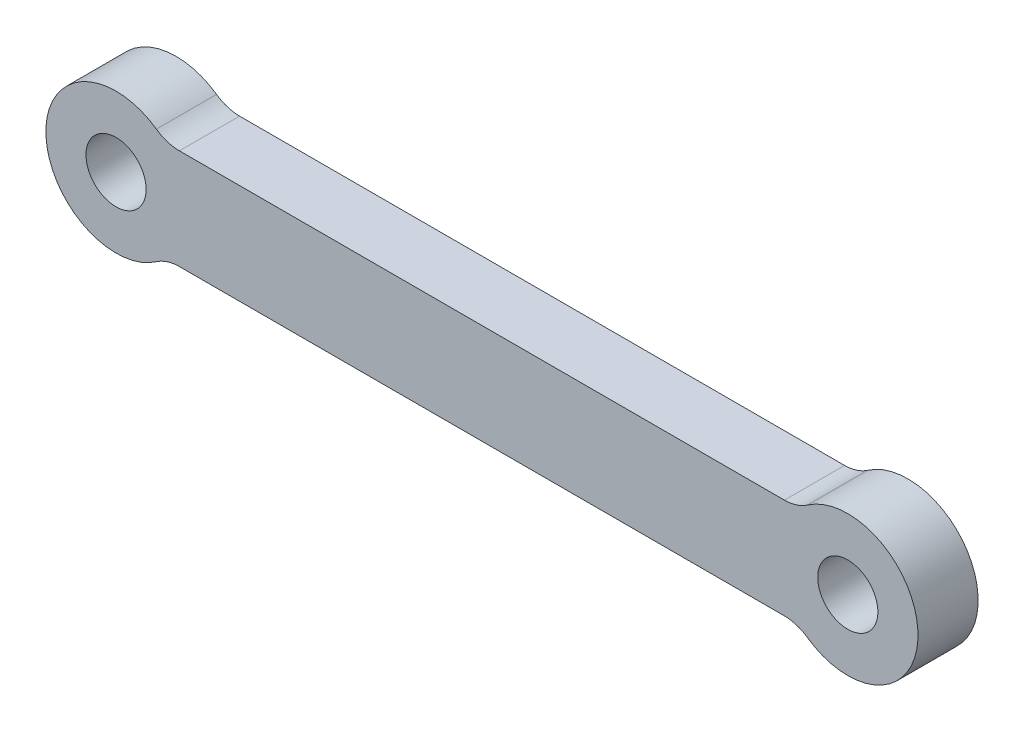
from build123d import *

# Parameters (mm, degrees)
SKETCH_1_R      = 1.5
EXTRUDE_1_DEPTH = 3


with BuildPart() as part:
    # 草图1 → 凸台-拉伸1 (new body)
    with BuildSketch(Plane.XY):
        with BuildLine():
            Line((3.16227766, 2.5), (33.33772234, 2.5))
            ThreePointArc((33.33772234, 2.5), (33.940745029, 2.593074822), (34.487641489, 2.863636364))
            ThreePointArc((34.487641489, 2.863636364), (40, 0), (34.487641489, -2.863636364))
            ThreePointArc((34.487641489, -2.863636364), (33.940745029, -2.593074822), (33.33772234, -2.5))
            Line((33.33772234, -2.5), (3.16227766, -2.5))
            ThreePointArc((3.16227766, -2.5), (2.559254971, -2.593074822), (2.012358511, -2.863636364))
            ThreePointArc((2.012358511, -2.863636364), (-3.5, 0), (2.012358511, 2.863636364))
            ThreePointArc((2.012358511, 2.863636364), (2.559254971, 2.593074822), (3.16227766, 2.5))
        make_face()
        Circle(SKETCH_1_R, mode=Mode.SUBTRACT)
        with Locations((36.5, 0)):
            Circle(SKETCH_1_R, mode=Mode.SUBTRACT)
    extrude(amount=EXTRUDE_1_DEPTH)


solid = part.part
